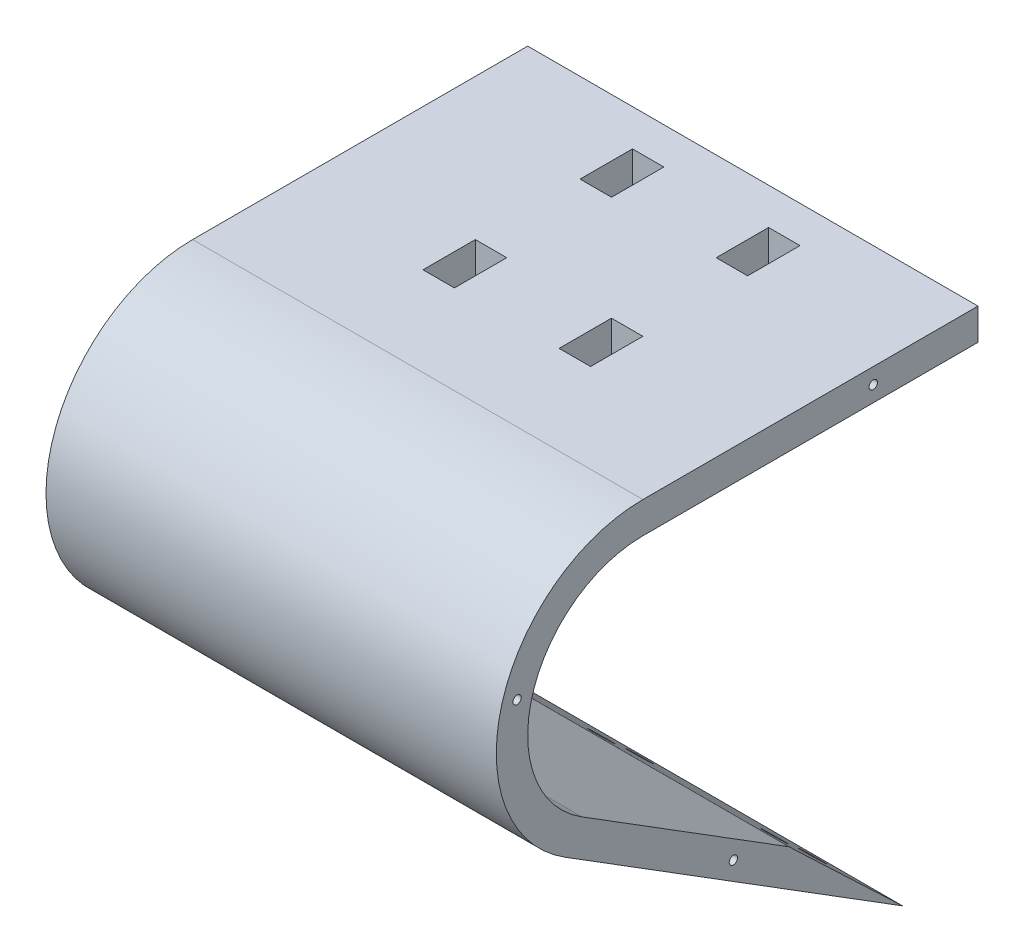
from build123d import *

# Parameters (mm, degrees)
SKETCH_2_W               = 43
SKETCH_2_H               = 32
EXTRUDE_1_DEPTH          = 3
EXTRUDE_2_DEPTH          = 43
SKETCH_4_W               = 3
SKETCH_4_H               = 5
CUT_EXTRUDE_1_DEPTH      = 67.543791262
SKETCH_5_R               = 0.4
CUT_EXTRUDE_2_DEPTH      = 3
CUT_EXTRUDE_START        = -40
SKETCH_5_3_R             = 0.4
CUT_EXTRUDE_3_DEPTH      = 3
CUT_EXTRUDE_4_DEPTH      = 77.255007413
CUT_EXTRUDE_4_DEPTH_BACK = 77.255007413
SKETCH_8_R               = 1.1
CUT_EXTRUDE_5_DEPTH      = 44.977948296


with BuildPart() as part:
    # 草图2 → 凸台-拉伸1 (new body)
    with BuildSketch(Plane(origin=(0, 0, 0), x_dir=(1, 0, 0), z_dir=(0, 1, 0))):
        with Locations((0, -16)):
            Rectangle(SKETCH_2_W, SKETCH_2_H)
    extrude(amount=EXTRUDE_1_DEPTH)

    # 草图3 → 凸台-拉伸2 (add)
    with BuildSketch(Plane(origin=(21.5, 0, 0), x_dir=(0, 0, -1), z_dir=(1, 0, 0))):
        with BuildLine():
            ThreePointArc((-37.829111907, -20.328529058), (-42.573878655, -7.967989086), (-32, 0))
            Line((-32, 0), (-23.339745962, 0))
            ThreePointArc((-23.339745962, 0), (-43.453167914, -2.948606038), (-39.418869699, -22.872673346))
            Line((-39.418869699, -22.872673346), (-7.193042045, -43.009605387))
            Line((-7.193042045, -43.009605387), (-5.603284253, -40.465461099))
            Line((-5.603284253, -40.465461099), (-37.829111907, -20.328529058))
        make_face()
    extrude(amount=-EXTRUDE_2_DEPTH)

    # 草图4 → 切除-拉伸1 (cut, through all)
    with BuildSketch(Plane.XZ):
        with Locations((6.5, 6)):
            Rectangle(SKETCH_4_W, SKETCH_4_H)
        with Locations((6.5, 21)):
            Rectangle(SKETCH_4_W, SKETCH_4_H)
        with Locations((-6.5, 6)):
            Rectangle(SKETCH_4_W, SKETCH_4_H)
        with Locations((-6.5, 21)):
            Rectangle(SKETCH_4_W, SKETCH_4_H)
    extrude(amount=-CUT_EXTRUDE_1_DEPTH, mode=Mode.SUBTRACT)

    # 草图5 → 切除-拉伸2 (cut)
    with BuildSketch(Plane(origin=(21.5, 0, 0), x_dir=(0, 0, -1), z_dir=(1, 0, 0))):
        with Locations((-10, 1.5)):
            Circle(SKETCH_5_R)
        with Locations((-44.015771199, -7.554533052)):
            Circle(SKETCH_5_R)
        with Locations((-23.359125072, -31.139147958)):
            Circle(SKETCH_5_R)
    extrude(amount=-CUT_EXTRUDE_2_DEPTH, mode=Mode.SUBTRACT)

    # 草图5<3> → 切除-拉伸3 (cut)
    with BuildSketch(Plane(origin=(21.5, 0, 0), x_dir=(0, 0, -1), z_dir=(1, 0, 0)).offset(CUT_EXTRUDE_START)):
        with Locations((-10, 1.5)):
            Circle(SKETCH_5_3_R)
        with Locations((-44.015771199, -7.554533052)):
            Circle(SKETCH_5_3_R)
        with Locations((-23.359125072, -31.139147958)):
            Circle(SKETCH_5_3_R)
    extrude(amount=-CUT_EXTRUDE_3_DEPTH, mode=Mode.SUBTRACT)

    # 草图6 → 切除-拉伸4 (cut, two sides: drawn at the far end of the back side and taken through both)
    with BuildSketch(Plane(origin=(21.5, 0, 0), x_dir=(0, 0, -1), z_dir=(1, 0, 0)).offset(-CUT_EXTRUDE_4_DEPTH_BACK)):
        Polygon((-18.06699493, -32.677270285), (-7.193042045, -43.009605387), (-5.603284253, -40.465461099), align=None)
    extrude(amount=CUT_EXTRUDE_4_DEPTH + CUT_EXTRUDE_4_DEPTH_BACK, mode=Mode.SUBTRACT)

    # 草图8 → 切除-拉伸5 (cut, through all)
    with BuildSketch(Plane(origin=(0, -26.194402521, 24.8896926), x_dir=(1, 0, 0), z_dir=(0, 0.7249301923221455, -0.6888223401282635))):
        with Locations(Location((16.5, 19.411523677, 0), (0, 0, 270))):
            Circle(SKETCH_8_R)
        with Locations(Location((16.5, 14.411523677, 0), (0, 0, 270))):
            Circle(SKETCH_8_R)
        with Locations(Location((0, 14.411523677, 0), (0, 0, 270))):
            Circle(SKETCH_8_R)
        with Locations(Location((0, 19.411523677, 0), (0, 0, 270))):
            Circle(SKETCH_8_R)
        with Locations(Location((-16.5, 19.411523677, 0), (0, 0, 270))):
            Circle(SKETCH_8_R)
        with Locations(Location((-16.5, 14.411523677, 0), (0, 0, 270))):
            Circle(SKETCH_8_R)
    extrude(amount=-CUT_EXTRUDE_5_DEPTH, mode=Mode.SUBTRACT)


solid = part.part
